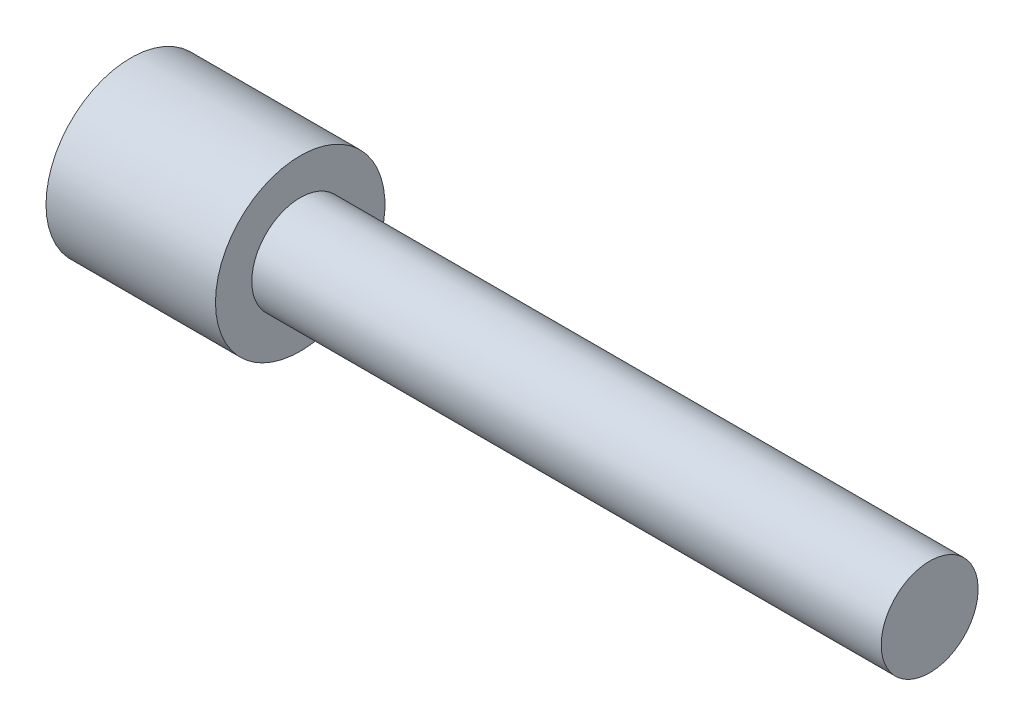
from build123d import *


with BuildPart() as part:
    # Sketch1 → Revolve1 (revolve)
    with BuildSketch(Plane.XY, mode=Mode.PRIVATE) as revolve1_sk:
        Polygon((0, 0), (13.198795181, 0), (13.198795181, 1), (0.198795181, 1), (0.198795181, 1.75), (-3.301204819, 1.75), (-3.301204819, 0), align=None)
    revolve(revolve1_sk.sketch.rotate(Axis((-3.301204819, 0, 0), (1, 0, 0)), 90), axis=Axis((-3.301204819, 0, 0), (1, 0, 0)))


solid = part.part
